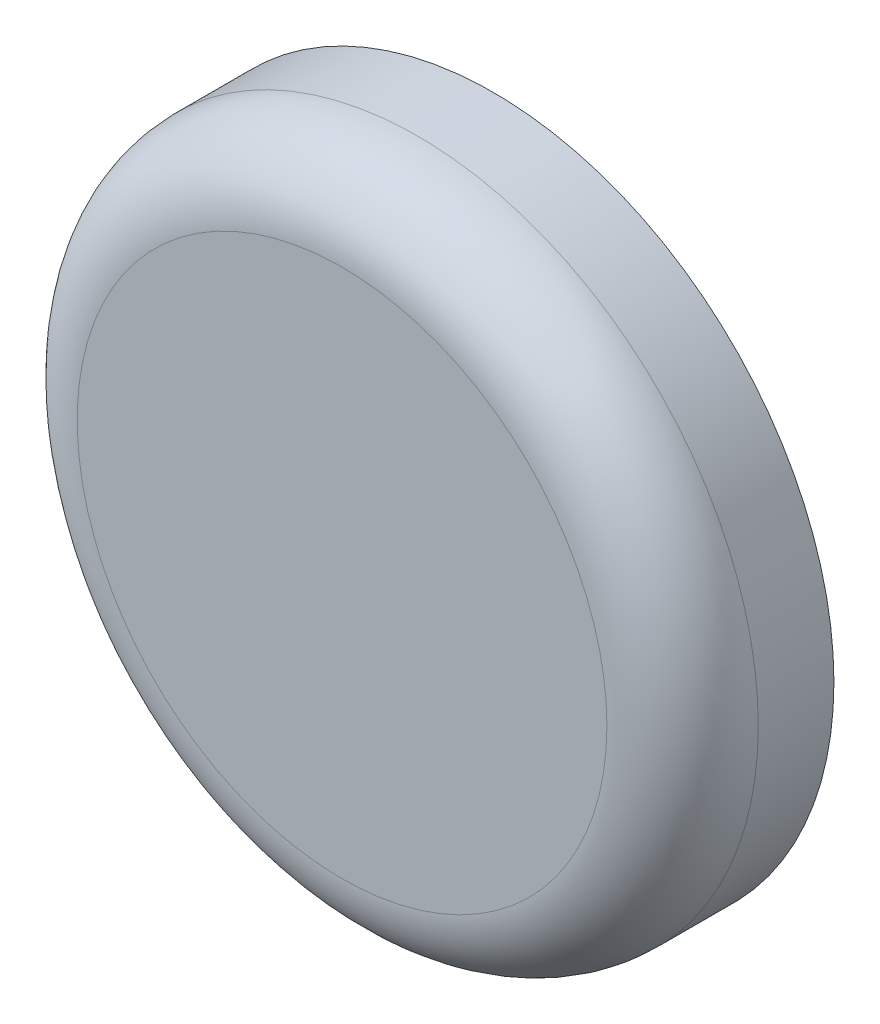
from build123d import *

# Parameters (mm, degrees)
SKETCH_1_R      = 4.5
EXTRUDE_1_DEPTH = 2
FILLET_1_R      = 1


with BuildPart() as part:
    # Эскиз1 → Бобышка-Вытянуть1 (new body)
    with BuildSketch(Plane.XY):
        Circle(SKETCH_1_R)
    extrude(amount=EXTRUDE_1_DEPTH)

    # Скругление1
    fillet_1_edges = [part.edges().sort_by_distance(p)[0] for p in [
        (-4.5, 0, 2),
    ]]
    fillet(fillet_1_edges, radius=FILLET_1_R)


solid = part.part
